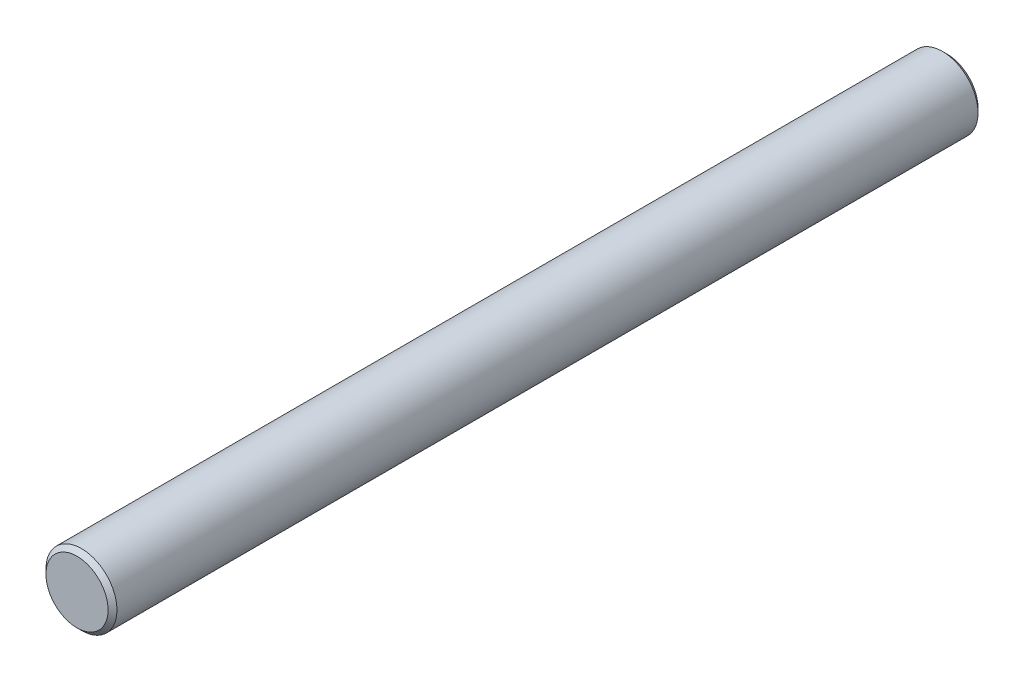
from build123d import *

# Parameters (mm, degrees)
SKETCH1_R           = 4
BOSS_EXTRUDE1_DEPTH = 98
CHAMFER1_SIZE       = 0.5


with BuildPart() as part:
    # Sketch1 → Boss-Extrude1 (new body)
    with BuildSketch(Plane.XY):
        Circle(SKETCH1_R)
    extrude(amount=BOSS_EXTRUDE1_DEPTH)

    # Chamfer1
    chamfer1_edges = [part.edges().sort_by_distance(p)[0] for p in [
        (-4, 0, 0),
        (-4, 0, 98),
    ]]
    chamfer(chamfer1_edges, length=CHAMFER1_SIZE)


solid = part.part
